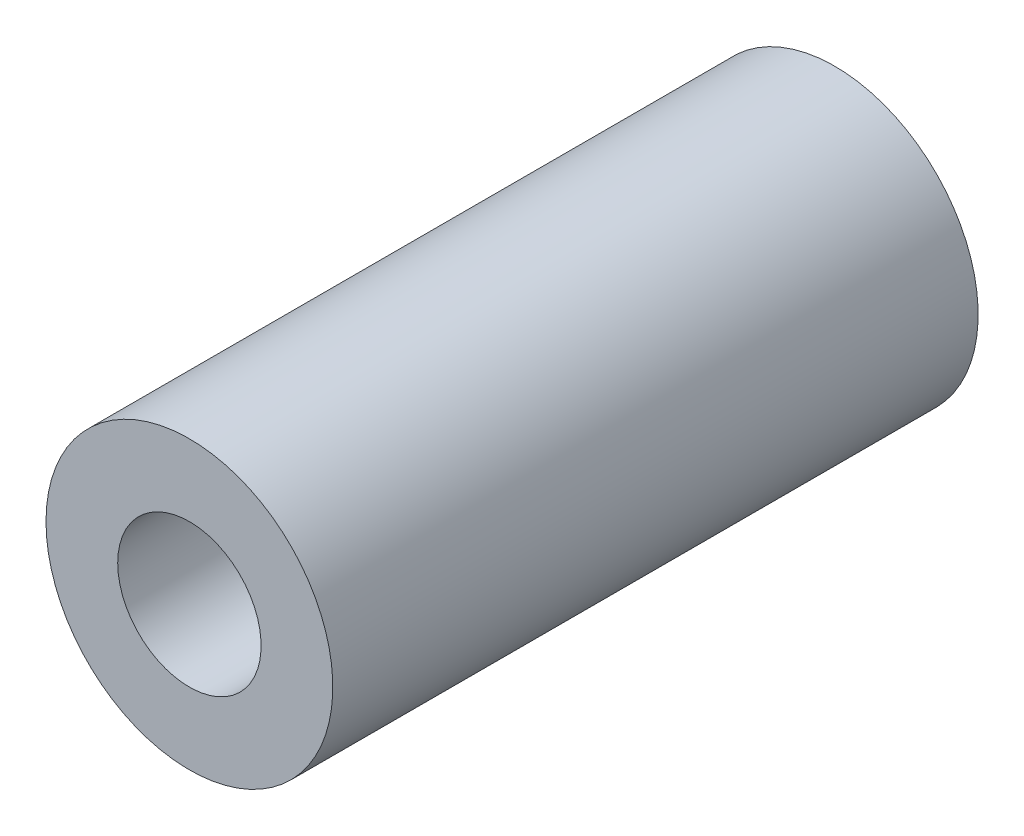
from build123d import *

# Parameters (mm, degrees)
ESQUISSE1_R        = 10
ESQUISSE1_R_2      = 5
BOSS_EXTRU_1_DEPTH = 45


with BuildPart() as part:
    # Esquisse1 → Boss.-Extru.1 (new body)
    with BuildSketch(Plane.XY):
        with Locations(Location((0, 0, 0), (0, 0, 180))):
            Circle(ESQUISSE1_R)
        with Locations(Location((0, 0, 0), (0, 0, 180))):
            Circle(ESQUISSE1_R_2, mode=Mode.SUBTRACT)
    extrude(amount=BOSS_EXTRU_1_DEPTH)


solid = part.part
